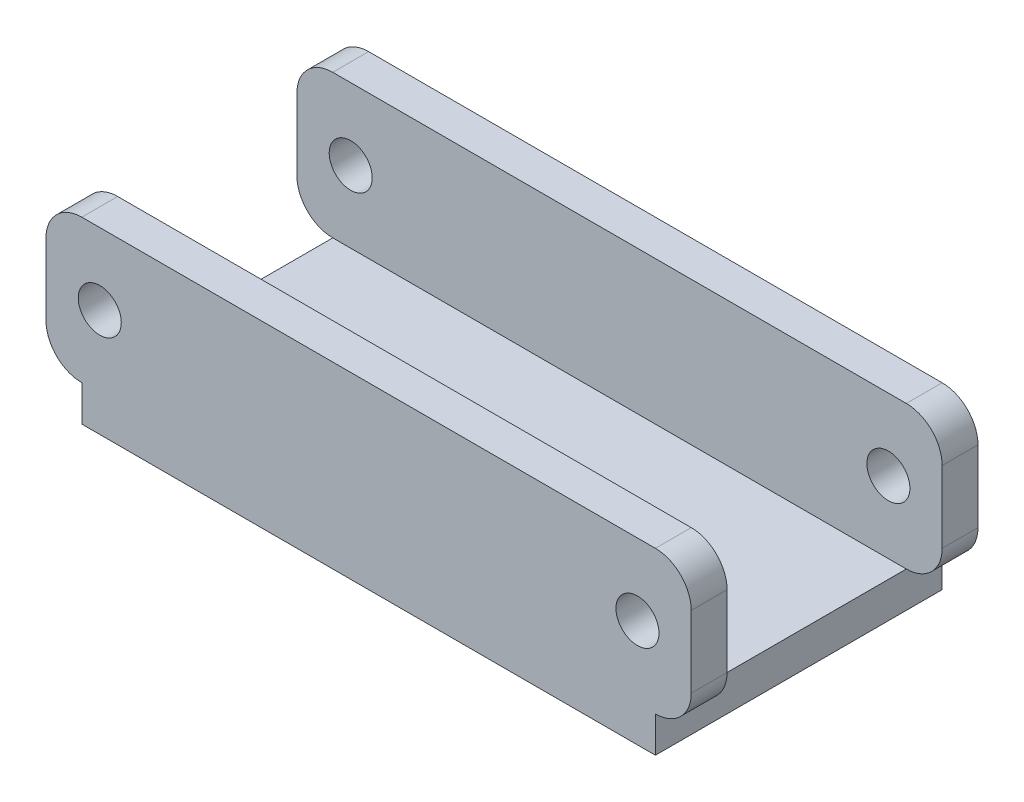
from build123d import *

# Parameters (mm, degrees)
SKETCH2_W           = 900
SKETCH2_H           = 200
BOSS_EXTRUDE1_DEPTH = 400
SKETCH3_W           = 1697.05478925
SKETCH3_H           = 300
CUT_EXTRUDE1_DEPTH  = 400
FILLET1_R           = 50
FILLET2_R           = 50
SKETCH4_R           = 30
CUT_EXTRUDE3_DEPTH  = 611.327780787
SKETCH4_2_W         = 800
SKETCH4_2_H         = 400
BOSS_EXTRUDE2_DEPTH = 50


with BuildPart() as part:
    # Sketch2 → Boss-Extrude1 (new body)
    with BuildSketch(Plane.XY):
        Rectangle(SKETCH2_W, SKETCH2_H)
    extrude(amount=BOSS_EXTRUDE1_DEPTH)

    # Sketch3 → Cut-Extrude1 (cut)
    with BuildSketch(Plane(origin=(0, 100, 0), x_dir=(1, 0, 0), z_dir=(0, 1, 0))):
        with Locations((0, -200)):
            Rectangle(SKETCH3_W, SKETCH3_H)
    extrude(amount=-CUT_EXTRUDE1_DEPTH, mode=Mode.SUBTRACT)


with BuildPart() as cut_extrude1_piece_1:
    # of the separate pieces the step leaves, piece 1, a body of its own (cut_extrude1_pieces)
    add(part.part.solids().sort_by_distance((-450, -100, 0))[0])

    # Fillet2
    fillet2_edges = [cut_extrude1_piece_1.edges().sort_by_distance(p)[0] for p in [
        (450, -100, 25),
        (-450, -100, 25),
        (-450, 100, 25),
        (450, 100, 25),
    ]]
    fillet(fillet2_edges, radius=FILLET2_R)


with BuildPart() as cut_extrude1_piece_2:
    # of the separate pieces the step leaves, piece 2, a body of its own (cut_extrude1_pieces)
    add(part.part.solids().sort_by_distance((-450, -100, 350))[0])

    # Fillet1
    fillet1_edges = [cut_extrude1_piece_2.edges().sort_by_distance(p)[0] for p in [
        (450, -100, 375),
        (450, 100, 375),
        (-450, 100, 375),
        (-450, -100, 375),
    ]]
    fillet(fillet1_edges, radius=FILLET1_R)


with BuildPart() as cut_extrude3_tool:
    # Sketch4 → Cut-Extrude3 (new, through all)
    with BuildSketch(Plane.XY.offset(400)):
        with Locations((-375, 0)):
            Circle(SKETCH4_R)
        with Locations((375, 0)):
            Circle(SKETCH4_R)
    extrude(amount=-CUT_EXTRUDE3_DEPTH)


with BuildPart() as cut_extrude1_piece_1_1:
    add(cut_extrude1_piece_1.part)

    # Cut-Extrude3: cut by cut_extrude3_tool
    add(cut_extrude3_tool.part, mode=Mode.SUBTRACT)



with BuildPart() as cut_extrude1_piece_2_1:
    add(cut_extrude1_piece_2.part)

    # Cut-Extrude3: cut by cut_extrude3_tool
    add(cut_extrude3_tool.part, mode=Mode.SUBTRACT)


with BuildPart() as cut_extrude1_piece_1_2:
    add(cut_extrude1_piece_1_1.part)

    add(cut_extrude1_piece_2_1.part)  # Boss-Extrude2 merges Cut-Extrude1 piece 2
    # Sketch4 2 → Boss-Extrude2 (add)
    with BuildSketch(Plane.XZ.offset(100)):
        with Locations((0, 200)):
            Rectangle(SKETCH4_2_W, SKETCH4_2_H)
    extrude(amount=BOSS_EXTRUDE2_DEPTH)


solid = cut_extrude1_piece_1_2.part
